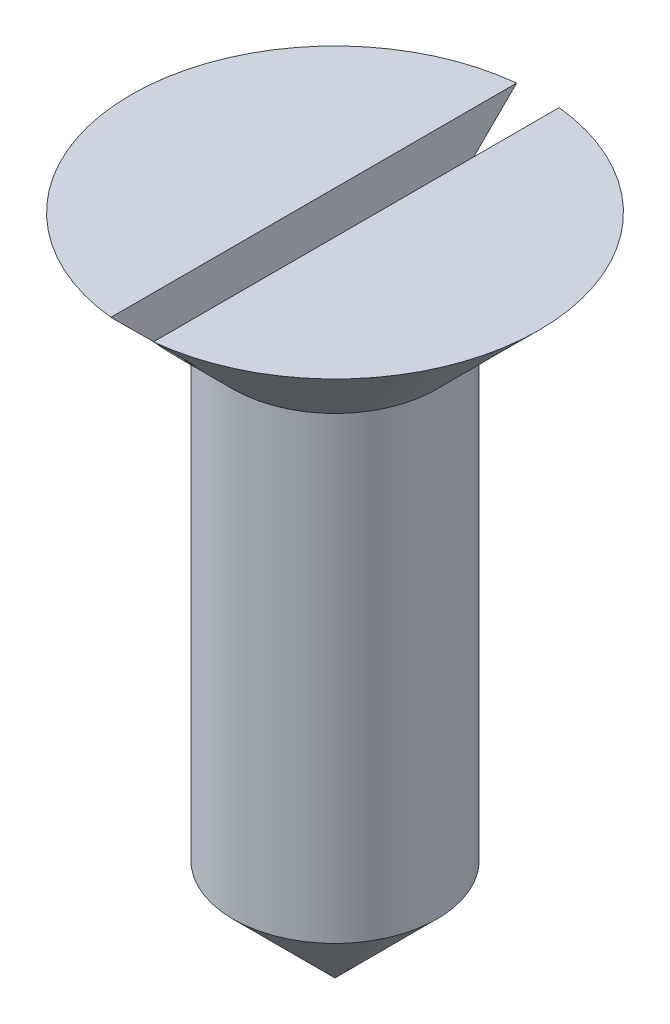
from build123d import *

# Parameters (mm, degrees)
CUT_EXTRUDE1_DEPTH      = 43.532340636
CUT_EXTRUDE1_DEPTH_BACK = 43.532340636
SKETCH2_W               = 2.5
SKETCH2_H               = 2.5


with BuildPart() as part:
    # Sketch1 → Revolve1 (revolve)
    with BuildSketch(Plane(origin=(0, 0, 0), x_dir=(0, 0, -1), z_dir=(1, 0, 0)), mode=Mode.PRIVATE) as revolve1_sk:
        Polygon((0, 0), (6, 6), (6, 33), (12, 39), (0, 39), align=None)
    revolve(revolve1_sk.sketch.rotate(Axis((0, 39, 0), (0, -1, 0)), 180), axis=Axis((0, 39, 0), (0, -1, 0)))

    # Sketch2 → Cut-Extrude1 (cut, two sides: drawn at the far end of the back side and taken through both)
    with BuildSketch(Plane.XY.offset(-CUT_EXTRUDE1_DEPTH_BACK)):
        with Locations((0, 37.75)):
            Rectangle(SKETCH2_W, SKETCH2_H)
    extrude(amount=CUT_EXTRUDE1_DEPTH + CUT_EXTRUDE1_DEPTH_BACK, mode=Mode.SUBTRACT)


solid = part.part
